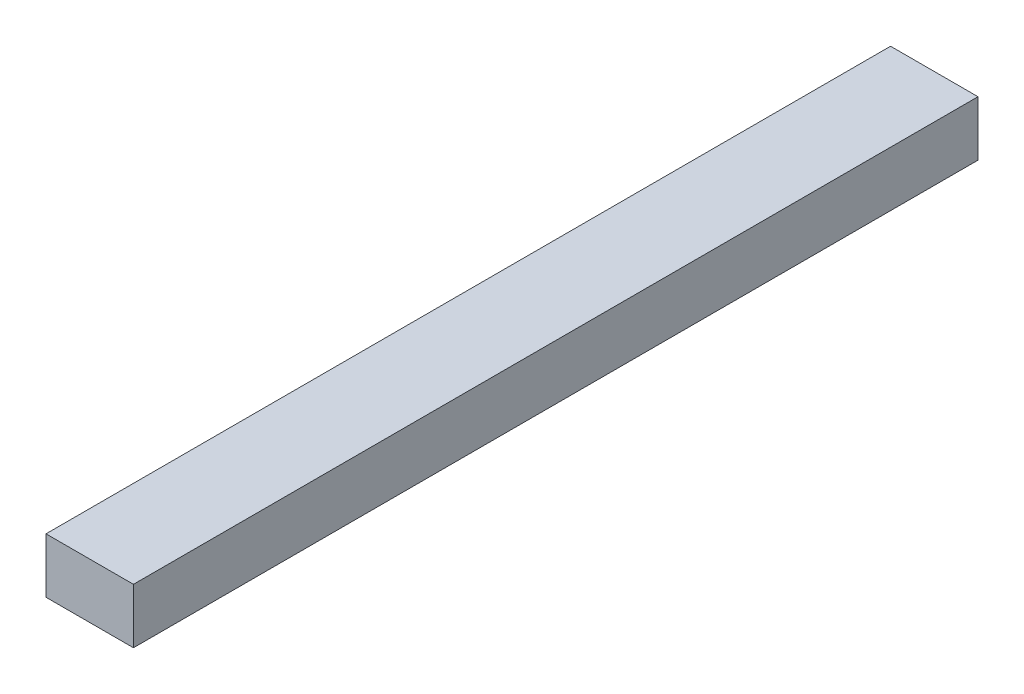
from build123d import *

# Parameters (mm, degrees)
SKETCH1_W           = 70
SKETCH1_H           = 44
BOSS_EXTRUDE1_DEPTH = 338


with BuildPart() as part:
    # Sketch1 → Boss-Extrude1 (new, symmetric)
    with BuildSketch(Plane.XY):
        Rectangle(SKETCH1_W, SKETCH1_H)
    extrude(amount=BOSS_EXTRUDE1_DEPTH, both=True)


solid = part.part
